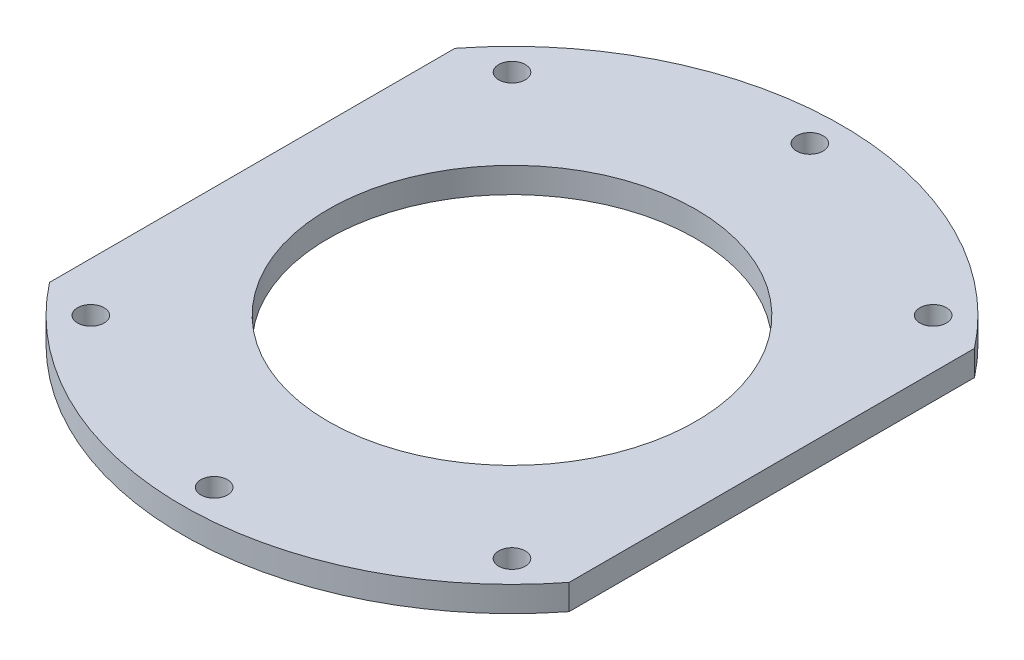
from build123d import *

# Parameters (mm, degrees)
SKETCH_1_R          = 52
SKETCH_1_R_2        = 29
SKETCH_1_R_3        = 2.1
EXTRUDE_1_DEPTH     = 4
SKETCH_2_W          = 182
SKETCH_2_H          = 210.035227354
SKETCH_2_W_2        = 82
SKETCH_2_H_2        = 110.035227354
CUT_EXTRUDE_1_DEPTH = 4


with BuildPart() as part:
    # 草图1 → 凸台-拉伸1 (new body)
    with BuildSketch(Plane(origin=(0, 0, 0), x_dir=(1, 0, 0), z_dir=(0, 1, 0))):
        with Locations(Location((0, 0, 0), (0, 0, 270))):
            Circle(SKETCH_1_R)
        with Locations(Location((0, 0, 0), (0, 0, 270))):
            Circle(SKETCH_1_R_2, mode=Mode.SUBTRACT)
        with Locations(Location((47, 0, 0), (0, 0, 270))):
            Circle(SKETCH_1_R_3, mode=Mode.SUBTRACT)
        with Locations(Location((33.234018716, -33.234018716, 0), (0, 0, 270))):
            Circle(SKETCH_1_R_3, mode=Mode.SUBTRACT)
        with Locations(Location((0, -47, 0), (0, 0, 270))):
            Circle(SKETCH_1_R_3, mode=Mode.SUBTRACT)
        with Locations(Location((-33.234018716, -33.234018716, 0), (0, 0, 270))):
            Circle(SKETCH_1_R_3, mode=Mode.SUBTRACT)
        with Locations(Location((-47, 0, 0), (0, 0, 270))):
            Circle(SKETCH_1_R_3, mode=Mode.SUBTRACT)
        with Locations(Location((-33.234018716, 33.234018716, 0), (0, 0, 270))):
            Circle(SKETCH_1_R_3, mode=Mode.SUBTRACT)
        with Locations(Location((0, 47, 0), (0, 0, 270))):
            Circle(SKETCH_1_R_3, mode=Mode.SUBTRACT)
        with Locations(Location((33.234018716, 33.234018716, 0), (0, 0, 270))):
            Circle(SKETCH_1_R_3, mode=Mode.SUBTRACT)
    extrude(amount=EXTRUDE_1_DEPTH)

    # 草图2 → 切除-拉伸-薄壁1 (cut)
    with BuildSketch(Plane(origin=(0, 4, 0), x_dir=(1, 0, 0), z_dir=(0, 1, 0))):
        Rectangle(SKETCH_2_W, SKETCH_2_H)
        Rectangle(SKETCH_2_W_2, SKETCH_2_H_2, mode=Mode.SUBTRACT)
    extrude(amount=-CUT_EXTRUDE_1_DEPTH, mode=Mode.SUBTRACT)


solid = part.part
